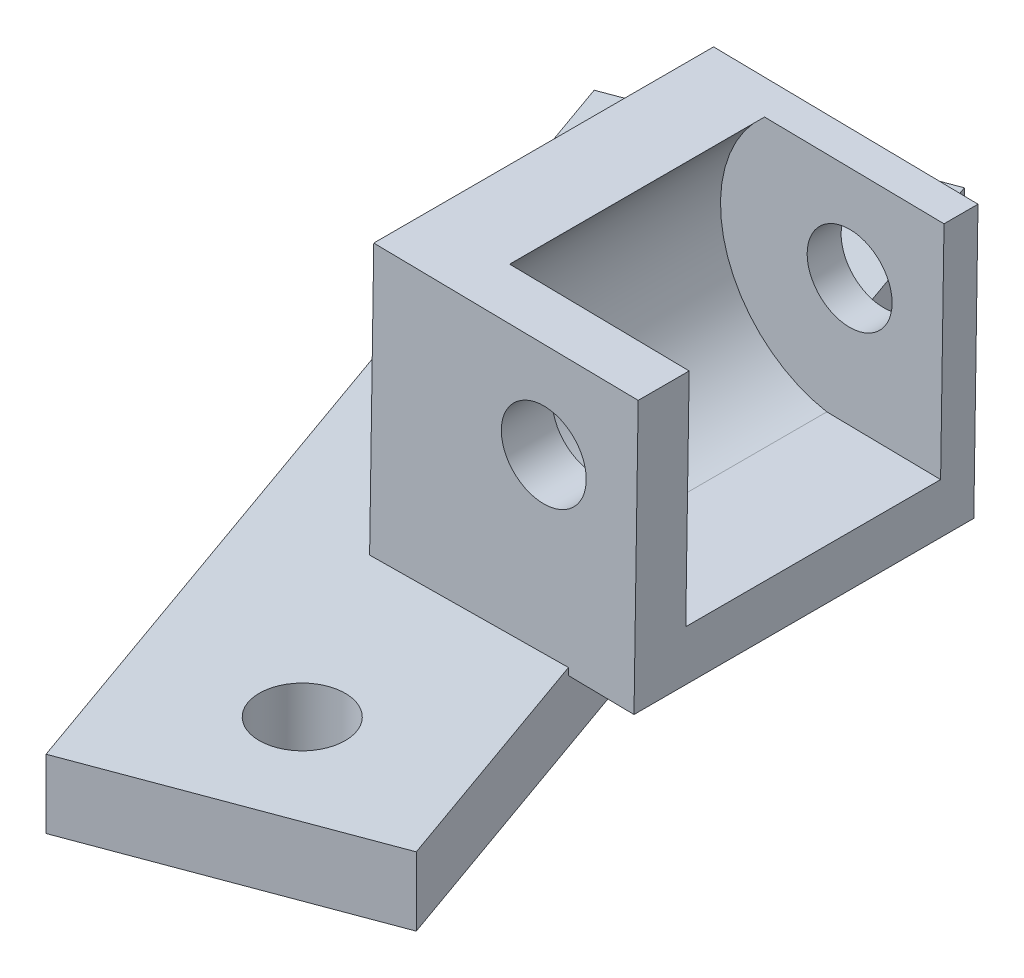
from build123d import *

# Parameters (mm, degrees)
BOSS_EXTRUDE1_DEPTH = 21.59
SKETCH2_R           = 3.175
BOSS_EXTRUDE3_DEPTH = 2.54
BOSS_EXTRUDE4_START = 3.81
SKETCH3_R           = 3.175
BOSS_EXTRUDE4_DEPTH = 3.81
SKETCH4_R           = 3.175
BOSS_EXTRUDE5_DEPTH = 5.08


with BuildPart() as part:
    # Sketch1 → Boss-Extrude1 (new body)
    with BuildSketch(Plane.XY):
        with BuildLine():
            Line((-621.150306902, 90.224895892), (-621.092144063, 94.034451914))
            Line((-621.092144063, 94.034451914), (-629.598897849, 94.164329766))
            ThreePointArc((-629.598897849, 94.164329766), (-632.210560309, 95.031876848), (-634.47123768, 96.601194079))
            ThreePointArc((-634.47123768, 96.601194079), (-637.543945735, 103.811741783), (-634.252545404, 110.925124722))
            Line((-634.252545404, 110.925124722), (-640.60180544, 111.022062787))
            Line((-640.60180544, 111.022062787), (-640.914721516, 90.52665139))
            Line((-640.914721516, 90.52665139), (-621.150306902, 90.224895892))
        make_face()
    extrude(amount=-BOSS_EXTRUDE1_DEPTH)

    # Sketch2 → Boss-Extrude3 (add)
    # profile 1 of 2: a face of its own
    with BuildSketch(Plane(origin=(0, 0, -19.05), x_dir=(-1, 0, 0), z_dir=(0, 0, -1))):
        with BuildLine():
            Line((620.837390826, 110.72030729), (621.056083102, 96.396376647))
            Line((621.056083102, 96.396376647), (634.47123768, 96.601194079))
            ThreePointArc((634.47123768, 96.601194079), (637.543945735, 103.811741783), (634.252545404, 110.925124722))
            Line((634.252545404, 110.925124722), (620.837390826, 110.72030729))
        make_face()
        with Locations(Location((627.893070479, 103.664395923, 0), (0, 0, 180))):
            Circle(SKETCH2_R, mode=Mode.SUBTRACT)
    # profile 2 of 2: a face of its own
    with BuildSketch(Plane(origin=(0, 0, -19.05), x_dir=(-1, 0, 0), z_dir=(0, 0, -1))):
        with BuildLine():
            Line((621.056083102, 96.396376647), (621.092144063, 94.034451914))
            Line((621.092144063, 94.034451914), (629.598897849, 94.164329766))
            ThreePointArc((629.598897849, 94.164329766), (632.210560309, 95.031876848), (634.47123768, 96.601194079))
            Line((634.47123768, 96.601194079), (621.056083102, 96.396376647))
        make_face()
    extrude(amount=BOSS_EXTRUDE3_DEPTH)

    # Sketch3 → Boss-Extrude4 (add)
    with BuildSketch(Plane.XY.offset(BOSS_EXTRUDE4_START)):
        Polygon((-640.60180544, 111.022062787), (-620.837390826, 110.72030729), (-621.150306902, 90.224895892), (-640.914721516, 90.52665139), align=None)
        with Locations((-627.893070479, 103.664395923)):
            Circle(SKETCH3_R, mode=Mode.SUBTRACT)
    extrude(amount=-BOSS_EXTRUDE4_DEPTH)

    # Sketch4 → Boss-Extrude5 (add)
    with BuildSketch(Plane(origin=(-1.009584834, 97.256608571, -1.08885119), x_dir=(0.9999461323694532, 0.010378769561310733, -0.00011619709707159695), z_dir=(-0.010379419992088095, 0.9998834703189057, -0.011194347843893974))):
        Polygon((-662.311032425, 34.336117125), (-638.844274196, -30.103991955), (-618.55757319, -22.71630881), (-642.024331418, 41.723800271), align=None)
        with Locations(Location((-649.125694743, 29.676611224, 0), (0, 0, 270))):
            Circle(SKETCH4_R, mode=Mode.SUBTRACT)
        with Locations(Location((-631.742910871, -18.056802909, 0), (0, 0, 270))):
            Circle(SKETCH4_R, mode=Mode.SUBTRACT)
    extrude(amount=-BOSS_EXTRUDE5_DEPTH)


solid = part.part
